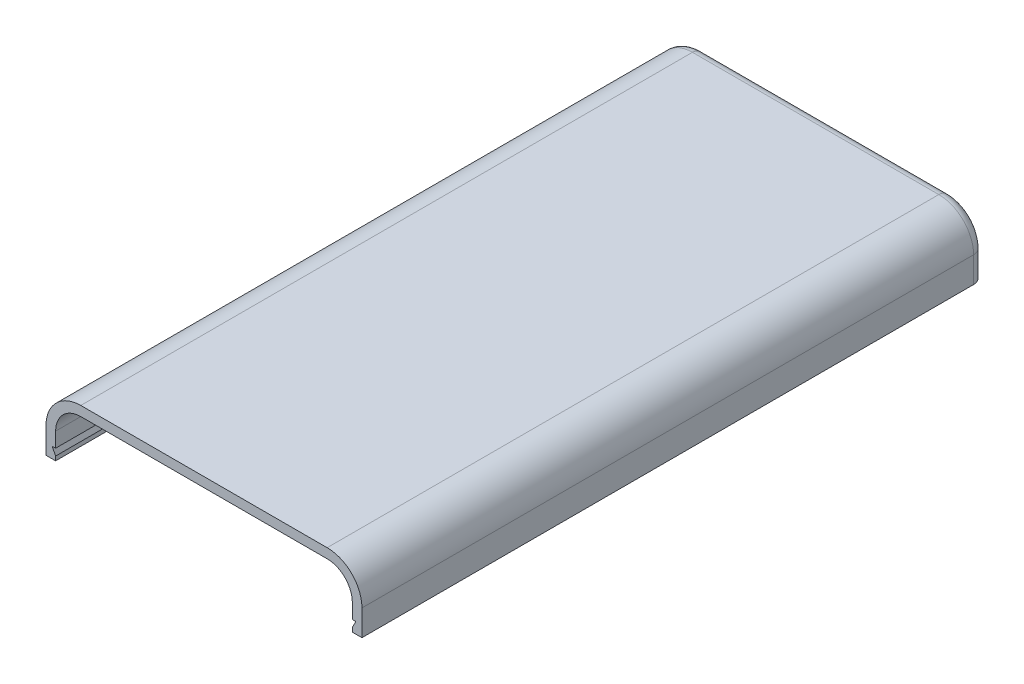
from build123d import *

# Parameters (mm, degrees)
BOSS_EXTRUDE1_DEPTH = 116.3
CUT_EXTRUDE1_DEPTH  = 112.7
FILLET1_R           = 2


with BuildPart() as part:
    # Sketch1 → Boss-Extrude1 (new body)
    with BuildSketch(Plane.XY):
        with BuildLine():
            Line((0, 0), (59.04, 0))
            Line((59.04, 0), (59.04, 4.82))
            ThreePointArc((59.04, 4.82), (57.136194078, 9.416194078), (52.54, 11.32))
            Line((52.54, 11.32), (6.5, 11.32))
            ThreePointArc((6.5, 11.32), (1.903805922, 9.416194078), (0, 4.82))
            Line((0, 4.82), (0, 0))
        make_face()
    extrude(amount=BOSS_EXTRUDE1_DEPTH)

    # Sketch2 → Cut-Extrude1 (cut)
    with BuildSketch(Plane.XY.offset(116.3)):
        with BuildLine():
            Line((1.8, 4.82), (1.8, 2.05))
            Line((1.8, 2.05), (1.8, 0.78))
            Line((1.8, 0.78), (1.8, 0))
            Line((1.8, 0), (57.24, 0))
            Line((57.24, 0), (57.24, 0.78))
            Line((57.24, 0.78), (57.24, 2.05))
            Line((57.24, 2.05), (57.24, 4.82))
            ThreePointArc((57.24, 4.82), (55.863401872, 8.143401872), (52.54, 9.52))
            Line((52.54, 9.52), (6.5, 9.52))
            ThreePointArc((6.5, 9.52), (3.176598128, 8.143401872), (1.8, 4.82))
        make_face()
        Polygon((57.24, 2.05), (57.24, 0.78), (57.895, 2.05), align=None)
        Polygon((1.8, 0.78), (1.8, 2.05), (1.145, 2.05), align=None)
    extrude(amount=-CUT_EXTRUDE1_DEPTH, mode=Mode.SUBTRACT)

    # Fillet1
    fillet1_edges = [part.edges().sort_by_distance(p)[0] for p in [
        (1.903805922, 9.416194078, 0),
        (29.52, 11.32, 0),
        (57.136194078, 9.416194078, 0),
        (59.04, 2.41, 0),
        (0, 2.41, 0),
    ]]
    fillet(fillet1_edges, radius=FILLET1_R)


solid = part.part
